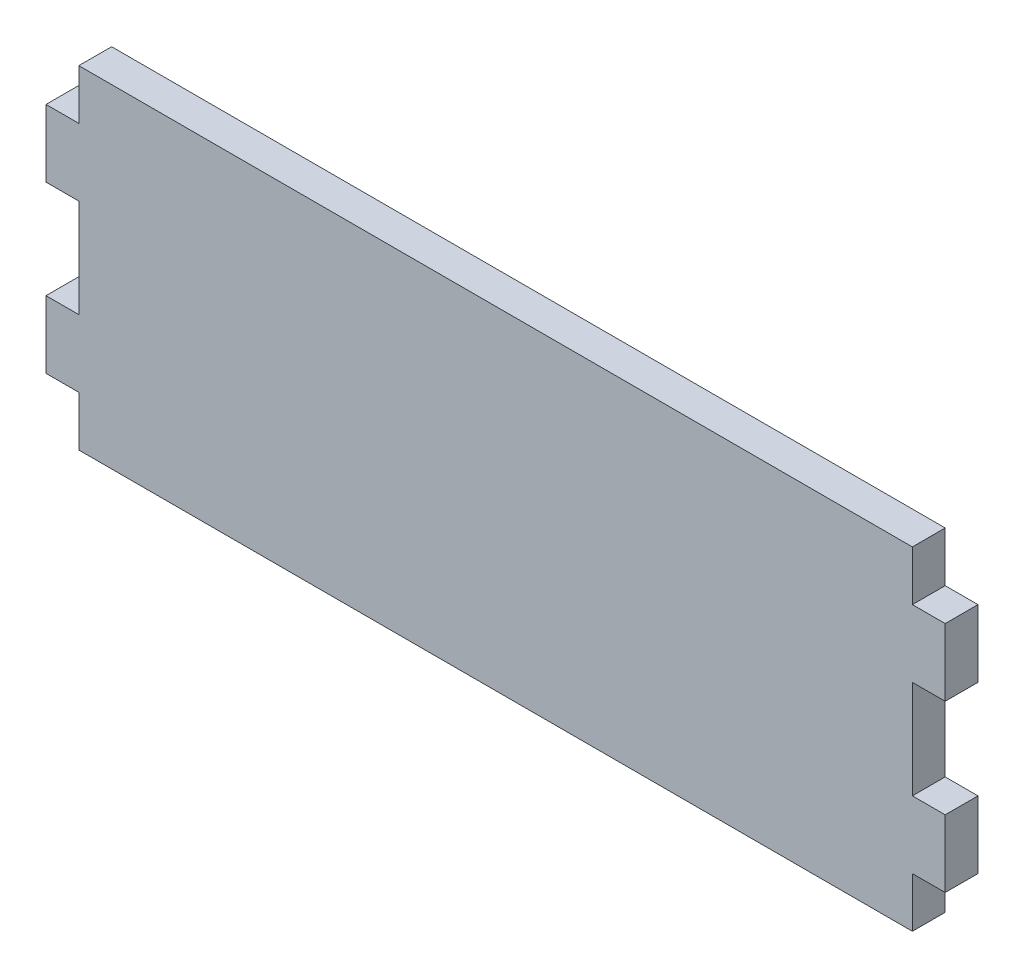
from build123d import *

# Parameters (mm, degrees)
SKETCH1_W           = 127
SKETCH1_H           = 50.719999906
BOSS_EXTRUDE1_DEPTH = 5
SKETCH2_W           = 5
SKETCH2_H           = 10.254787301
BOSS_EXTRUDE2_DEPTH = 5


with BuildPart() as part:
    # Sketch1 → Boss-Extrude1 (new body)
    with BuildSketch(Plane.XY):
        with Locations((0, 25.359999953)):
            Rectangle(SKETCH1_W, SKETCH1_H)
    extrude(amount=-BOSS_EXTRUDE1_DEPTH)

    # Sketch2 → Boss-Extrude2 (add)
    with BuildSketch(Plane(origin=(0, 0, -5), x_dir=(-1, 0, 0), z_dir=(0, 0, -1))):
        with Locations((-66, 12.743106261)):
            Rectangle(SKETCH2_W, SKETCH2_H)
        with Locations((-66, 37.976893645)):
            Rectangle(SKETCH2_W, SKETCH2_H)
        with Locations((66, 12.743106261)):
            Rectangle(SKETCH2_W, SKETCH2_H)
        with Locations((66, 37.976893645)):
            Rectangle(SKETCH2_W, SKETCH2_H)
    extrude(amount=-BOSS_EXTRUDE2_DEPTH)


solid = part.part
